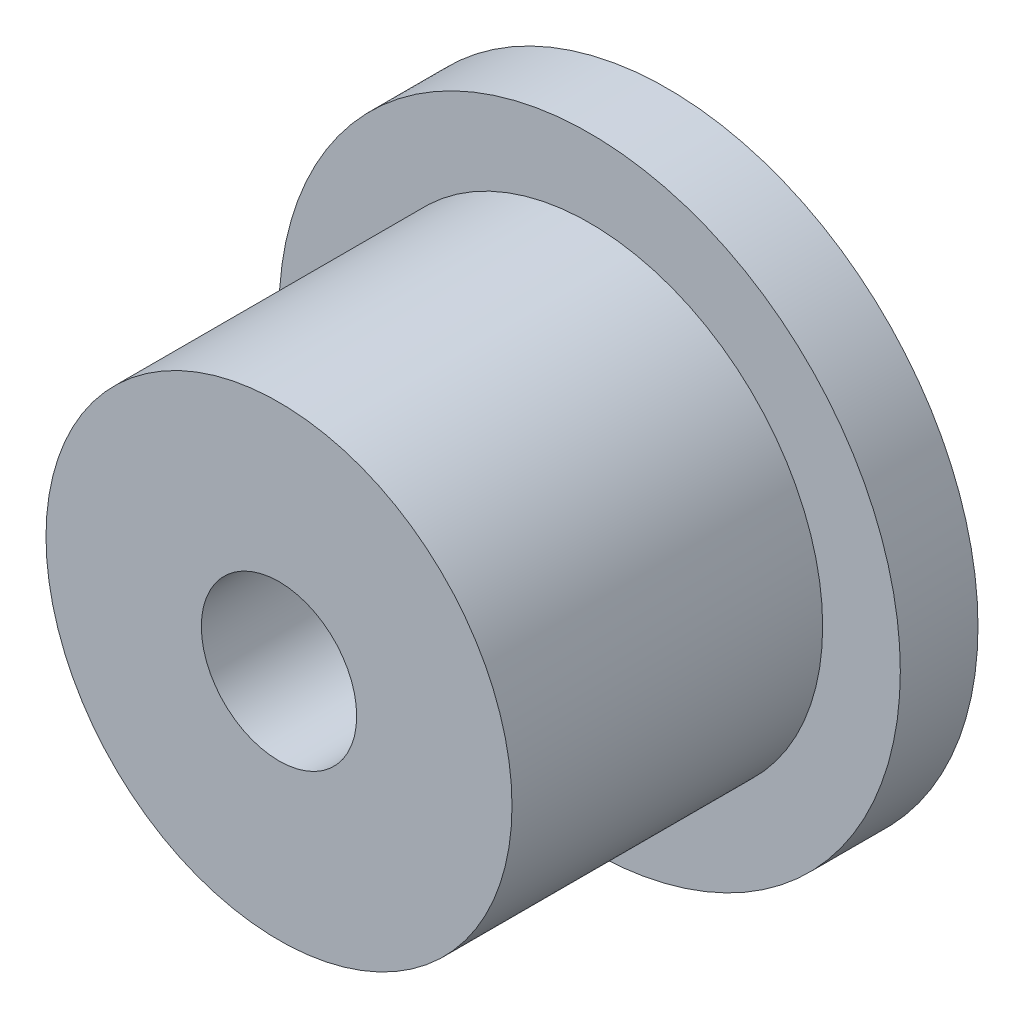
from build123d import *
from build123d.topology import SkipClean

# Parameters (mm, degrees)
SKETCH1_R           = 75
SKETCH1_R_2         = 25
BOSS_EXTRUDE1_DEPTH = 100
BOSS_EXTRUDE3_START = 25
SKETCH2_R           = 100
SKETCH2_R_2         = 25
BOSS_EXTRUDE3_DEPTH = 25


with BuildPart() as part:
    # Sketch1 → Boss-Extrude1 (new body)
    with BuildSketch(Plane.XY):
        Circle(SKETCH1_R)
        Circle(SKETCH1_R_2, mode=Mode.SUBTRACT)
    extrude(amount=BOSS_EXTRUDE1_DEPTH)

    # Sketch2 → Boss-Extrude3 (add)
    with SkipClean():  # the faces are left unmerged after this step: merging them gives an invalid solid
        with BuildSketch(Plane(origin=(0, 0, 0), x_dir=(-1, 0, 0), z_dir=(0, 0, -1)).offset(BOSS_EXTRUDE3_START)):
            Circle(SKETCH2_R)
            Circle(SKETCH2_R_2, mode=Mode.SUBTRACT)
        extrude(amount=-BOSS_EXTRUDE3_DEPTH)


solid = part.part
